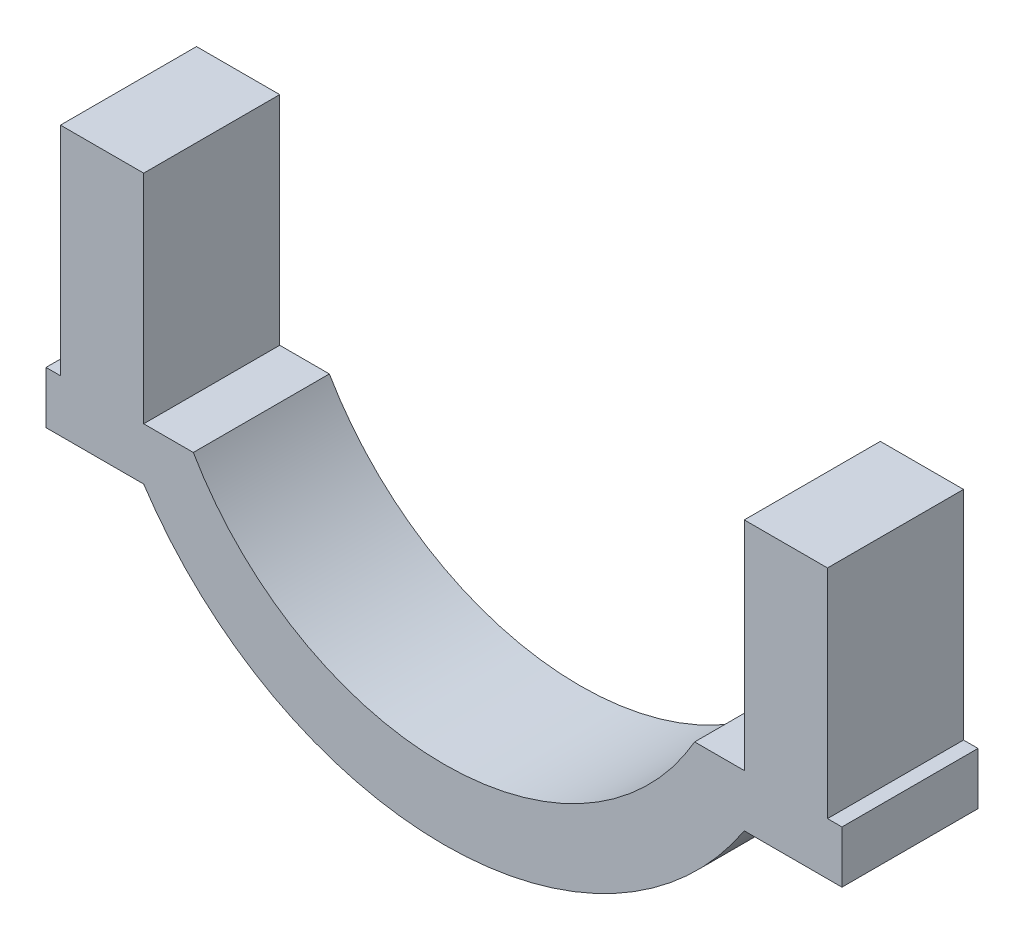
from build123d import *

# Parameters (mm, degrees)
BOSS_EXTRUDE1_DEPTH = 18.8


with BuildPart() as part:
    # Sketch1 → Boss-Extrude1 (new body)
    with BuildSketch(Plane.XY):
        with BuildLine():
            Line((41.5, -20), (34.641016151, -20))
            ThreePointArc((34.641016151, -20), (0, -40), (-34.641016151, -20))
            Line((-34.641016151, -20), (-41.5, -20))
            Line((-41.5, -20), (-41.5, 10))
            Line((-41.5, 10), (-53, 10))
            Line((-53, 10), (-53, -20))
            Line((-53, -20), (-55, -20))
            Line((-55, -20), (-55, -27.212333234))
            Line((-55, -27.212333234), (-41.5, -27.212333234))
            ThreePointArc((-41.5, -27.212333234), (0, -49.626213638), (41.5, -27.212333234))
            Line((41.5, -27.212333234), (55, -27.212333234))
            Line((55, -27.212333234), (55, -20))
            Line((55, -20), (53, -20))
            Line((53, -20), (53, 10))
            Line((53, 10), (41.5, 10))
            Line((41.5, 10), (41.5, -20))
        make_face()
    extrude(amount=-BOSS_EXTRUDE1_DEPTH)


solid = part.part
